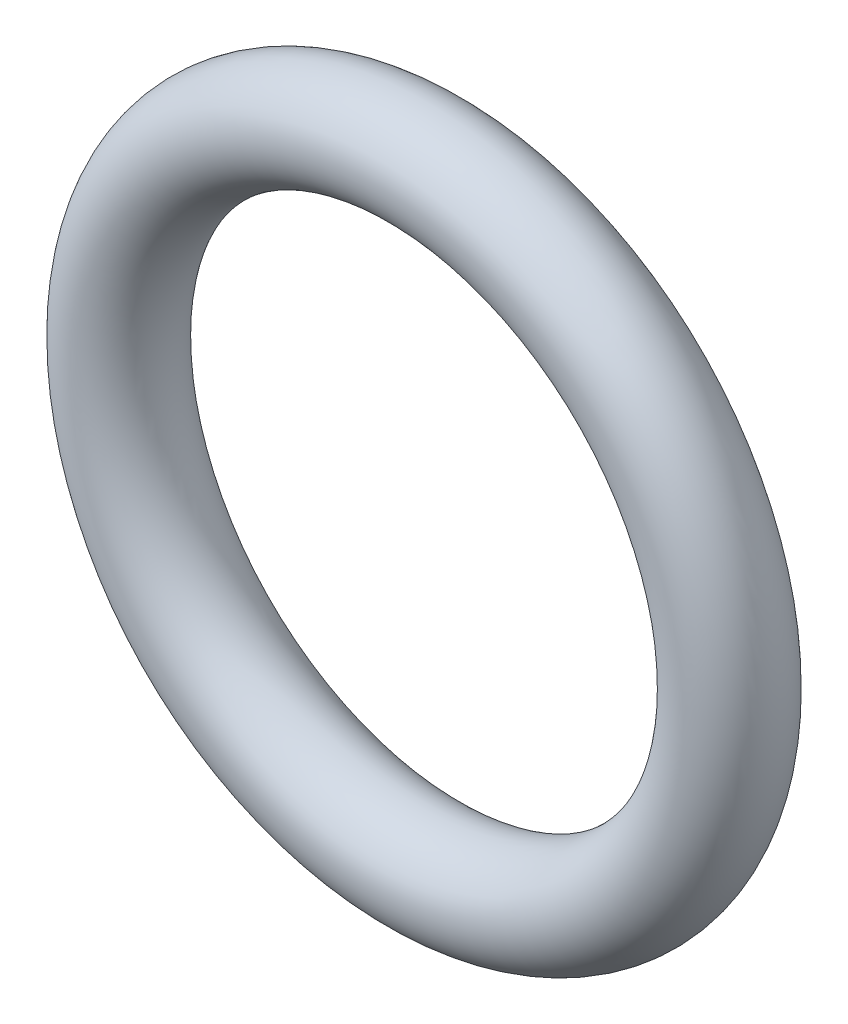
from build123d import *

# Parameters (mm, degrees)
SKETCH1_R = 25.4


with BuildPart() as part:
    # Sketch1 → Revolve1 (revolve)
    with BuildSketch(Plane(origin=(0, 0, 0), x_dir=(1, 0, 0), z_dir=(0, 1, 0)), mode=Mode.PRIVATE) as revolve1_sk:
        Circle(SKETCH1_R)
    revolve(revolve1_sk.sketch.rotate(Axis((152.4, 0, 0), (0, 0, -1)), 180), axis=Axis((152.4, 0, 0), (0, 0, -1)))


solid = part.part
